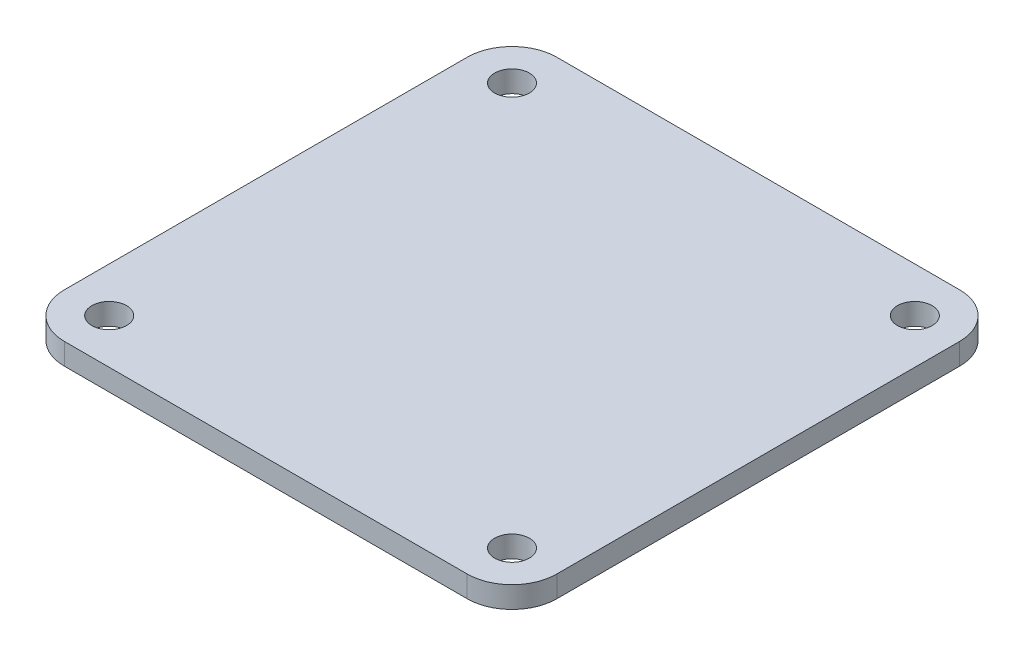
from build123d import *

# Parameters (mm, degrees)
SKETCH1_W           = 69.85
SKETCH1_H           = 69.85
BOSS_EXTRUDE1_DEPTH = 3.048
SKETCH2_R           = 2.45999
CUT_EXTRUDE1_DEPTH  = 99.829830031
FILLET2_R           = 6.35


with BuildPart() as part:
    # Sketch1 → Boss-Extrude1 (new body)
    with BuildSketch(Plane(origin=(0, 0, 0), x_dir=(1, 0, 0), z_dir=(0, 1, 0))):
        with Locations((34.925, 34.925)):
            Rectangle(SKETCH1_W, SKETCH1_H)
    extrude(amount=BOSS_EXTRUDE1_DEPTH)

    # Sketch2 → Cut-Extrude1 (cut, through all)
    with BuildSketch(Plane(origin=(0, 0, 0), x_dir=(1, 0, 0), z_dir=(0, 1, 0))):
        with Locations(Location((6.35, 6.35, 0), (0, 0, 90))):
            Circle(SKETCH2_R)
        with Locations(Location((63.5, 6.35, 0), (0, 0, 90))):
            Circle(SKETCH2_R)
        with Locations(Location((6.35, 63.5, 0), (0, 0, 90))):
            Circle(SKETCH2_R)
        with Locations(Location((63.5, 63.5, 0), (0, 0, 90))):
            Circle(SKETCH2_R)
    extrude(amount=CUT_EXTRUDE1_DEPTH, mode=Mode.SUBTRACT)

    # Fillet2
    fillet2_edges = [part.edges().sort_by_distance(p)[0] for p in [
        (0, 1.524, -69.85),
        (69.85, 1.524, -69.85),
        (69.85, 1.524, 0),
        (0, 1.524, 0),
    ]]
    fillet(fillet2_edges, radius=FILLET2_R)


solid = part.part
